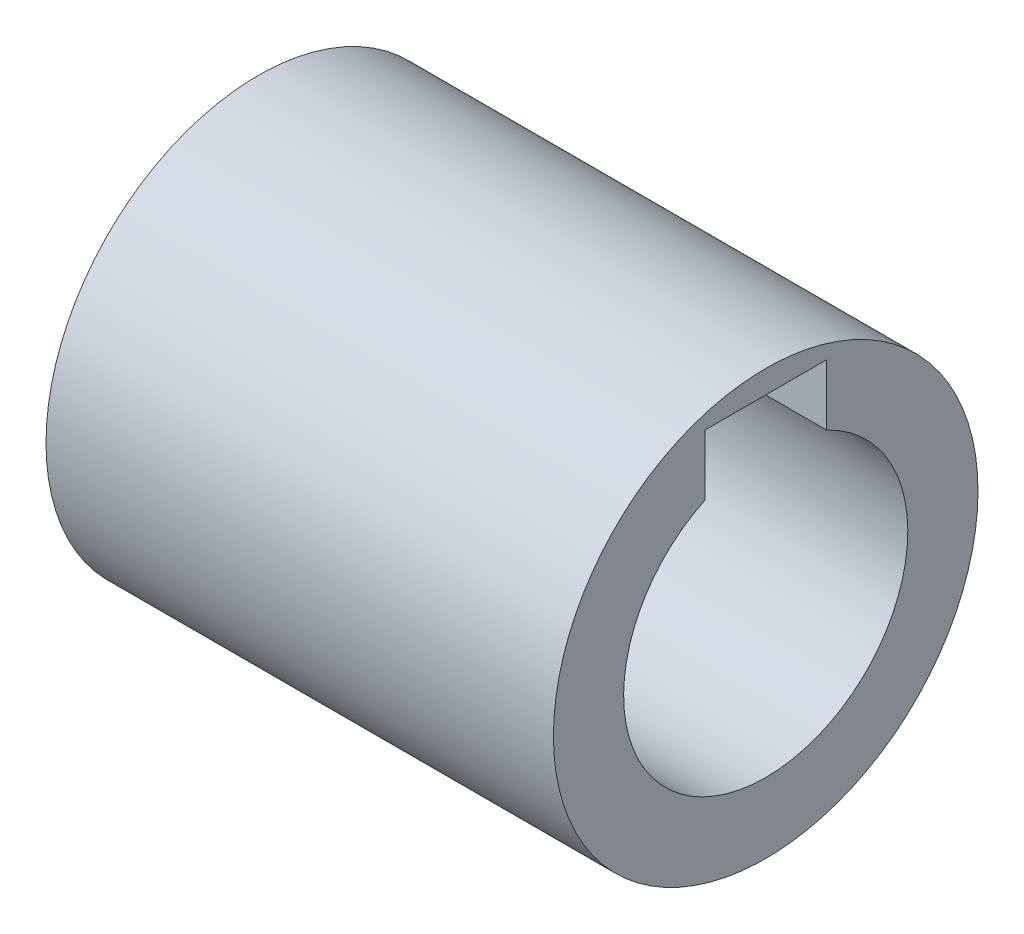
from build123d import *

# Parameters (mm, degrees)
ESQUISSE1_R        = 5.229323062
BOSS_EXTRU_1_DEPTH = 12.5


with BuildPart() as part:
    # Esquisse1 → Boss.-Extru.1 (new body)
    with BuildSketch(Plane(origin=(0, 0, 0), x_dir=(0, 0, -1), z_dir=(1, 0, 0))):
        Circle(ESQUISSE1_R)
        with BuildLine():
            Line((1.5, 4.66227766), (1.5, 3.16227766))
            ThreePointArc((1.5, 3.16227766), (0, -3.5), (-1.5, 3.16227766))
            Line((-1.5, 3.16227766), (-1.5, 4.66227766))
            Line((-1.5, 4.66227766), (1.5, 4.66227766))
        make_face(mode=Mode.SUBTRACT)
    extrude(amount=BOSS_EXTRU_1_DEPTH)


solid = part.part
